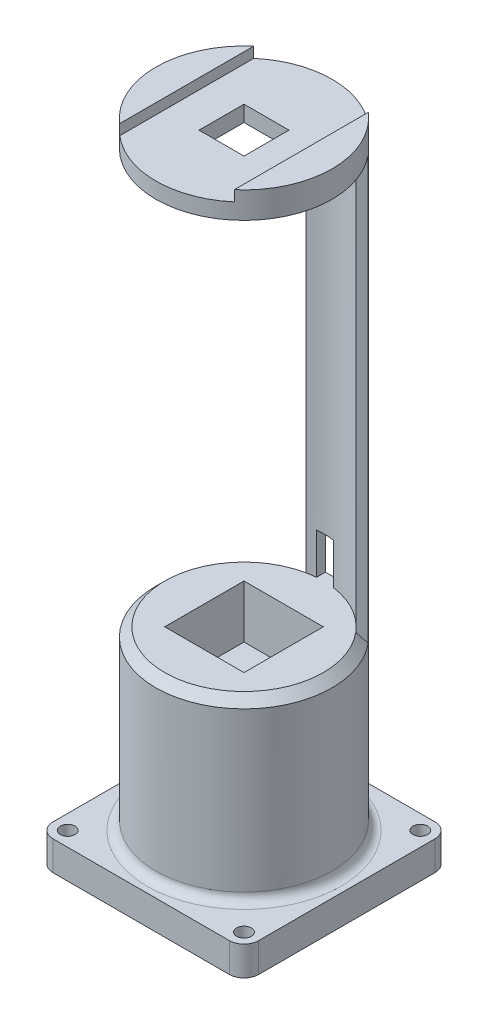
from build123d import *

# Parameters (mm, degrees)
SKETCH1_W                = 350
SKETCH1_H                = 350
BOSS_EXTRUDE1_DEPTH      = 50
FILLET1_R                = 25
SKETCH2_R                = 12.5
CUT_EXTRUDE1_DEPTH       = 50
SKETCH3_R                = 150
BOSS_EXTRUDE2_DEPTH      = 300
FILLET2_R                = 15
CHAMFER1_SIZE            = 15
SKETCH5_W                = 135
SKETCH5_H                = 135
CUT_EXTRUDE3_DEPTH       = 90
SCALE1_SCALE             = 0.333333333
EXTRUDE_THIN1_DEPTH      = 250
EXTRUDE_THIN1_DEPTH_BACK = 5
BOSS_EXTRUDE3_START      = -15
SKETCH7_R                = 50
BOSS_EXTRUDE3_DEPTH      = 15
SKETCH8_W                = 25.5
SKETCH8_H                = 25.5
CUT_EXTRUDE4_DEPTH       = 9.5
SKETCH9_W                = 65
SKETCH9_H                = 100
CUT_EXTRUDE5_DEPTH       = 6
SKETCH10_W               = 10
SKETCH10_H               = 23.333333333
CUT_EXTRUDE6_DEPTH       = 378.683913993
SKETCH12_R               = 37.5
CUT_EXTRUDE7_DEPTH       = 75


with BuildPart() as part:
    # Sketch1 → Boss-Extrude1 (new body)
    with BuildSketch(Plane(origin=(0, 0, 0), x_dir=(1, 0, 0), z_dir=(0, 1, 0))):
        with Locations((175, 175)):
            Rectangle(SKETCH1_W, SKETCH1_H)
    extrude(amount=-BOSS_EXTRUDE1_DEPTH)

    # Fillet1
    fillet1_edges = [part.edges().sort_by_distance(p)[0] for p in [
        (0, -25, -350),
        (350, -25, -350),
        (350, -25, 0),
        (0, -25, 0),
    ]]
    fillet(fillet1_edges, radius=FILLET1_R)

    # Sketch2 → Cut-Extrude1 (cut)
    with BuildSketch(Plane(origin=(0, 0, 0), x_dir=(1, 0, 0), z_dir=(0, 1, 0))):
        with Locations(Location((25, 25, 0), (0, 0, 270))):
            Circle(SKETCH2_R)
        with Locations(Location((325, 25, 0), (0, 0, 270))):
            Circle(SKETCH2_R)
        with Locations(Location((325, 325, 0), (0, 0, 270))):
            Circle(SKETCH2_R)
        with Locations(Location((25, 325, 0), (0, 0, 270))):
            Circle(SKETCH2_R)
    extrude(amount=-CUT_EXTRUDE1_DEPTH, mode=Mode.SUBTRACT)

    # Sketch3 → Boss-Extrude2 (add)
    with BuildSketch(Plane(origin=(0, 0, 0), x_dir=(1, 0, 0), z_dir=(0, 1, 0))):
        with Locations(Location((175, 175, 0), (0, 0, 90))):
            Circle(SKETCH3_R)
    extrude(amount=BOSS_EXTRUDE2_DEPTH)

    # Fillet2
    fillet2_edges = [part.edges().sort_by_distance(p)[0] for p in [
        (175, 0, -25),
    ]]
    fillet(fillet2_edges, radius=FILLET2_R)

    # Chamfer1
    chamfer1_edges = [part.edges().sort_by_distance(p)[0] for p in [
        (175, 300, -25),
    ]]
    chamfer(chamfer1_edges, length=CHAMFER1_SIZE)

    # Sketch5 → Cut-Extrude3 (cut)
    with BuildSketch(Plane.XZ.offset(-300)):
        with Locations((175, -175)):
            Rectangle(SKETCH5_W, SKETCH5_H)
    extrude(amount=CUT_EXTRUDE3_DEPTH, mode=Mode.SUBTRACT)


with BuildPart() as part_1:
    # Scale1: scaled about (0, 0, 0)
    add(part.part.scale(SCALE1_SCALE))

    # Sketch6 → Extrude-Thin1 (add, two sides: drawn at the far end of the back side and taken through both)
    with BuildSketch(Plane(origin=(0, 100, 0), x_dir=(1, 0, 0), z_dir=(0, 1, 0)).offset(-EXTRUDE_THIN1_DEPTH_BACK)):
        with BuildLine():
            ThreePointArc((48.391261826, 107.334917126), (74.830545561, 105.5333544), (96.635555489, 90.472713818))
            Line((96.635555489, 90.472713818), (92.805333274, 87.258775769))
            ThreePointArc((92.805333274, 87.258775769), (73.180824339, 100.813352293), (49.385468977, 102.434758746))
            Line((49.385468977, 102.434758746), (48.391261826, 107.334917126))
        make_face()
    extrude(amount=EXTRUDE_THIN1_DEPTH + EXTRUDE_THIN1_DEPTH_BACK)

    # Sketch7 → Boss-Extrude3 (add)
    with BuildSketch(Plane(origin=(0, 350, 0), x_dir=(1, 0, 0), z_dir=(0, 1, 0)).offset(BOSS_EXTRUDE3_START)):
        with Locations(Location((58.333333333, 58.333333333, 0), (0, 0, 90))):
            Circle(SKETCH7_R)
    extrude(amount=BOSS_EXTRUDE3_DEPTH)

    # Sketch8 → Cut-Extrude4 (cut)
    with BuildSketch(Plane.XZ.offset(-335)):
        with Locations((58.333333333, -58.333333333)):
            Rectangle(SKETCH8_W, SKETCH8_H)
    extrude(amount=-CUT_EXTRUDE4_DEPTH, mode=Mode.SUBTRACT)

    # Sketch9 → Cut-Extrude5 (cut)
    with BuildSketch(Plane(origin=(0, 350, 0), x_dir=(1, 0, 0), z_dir=(0, 1, 0))):
        with Locations((58.333333333, 58.333333333)):
            Rectangle(SKETCH9_W, SKETCH9_H)
    extrude(amount=-CUT_EXTRUDE5_DEPTH, mode=Mode.SUBTRACT)

    # Sketch10 → Cut-Extrude6 (cut, through all)
    with BuildSketch(Plane.XY.offset(-80.833333333)):
        with Locations((59.575622215, 111.666666667)):
            Rectangle(SKETCH10_W, SKETCH10_H)
    extrude(amount=-CUT_EXTRUDE6_DEPTH, mode=Mode.SUBTRACT)

    # Sketch12 → Cut-Extrude7 (cut)
    with BuildSketch(Plane(origin=(0, -16.666666667, 0), x_dir=(1, 0, 0), z_dir=(0, 1, 0))):
        with Locations(Location((58.333333333, 58.333333333, 0), (0, 0, 270))):
            Circle(SKETCH12_R)
    extrude(amount=CUT_EXTRUDE7_DEPTH, mode=Mode.SUBTRACT)


solid = part_1.part
